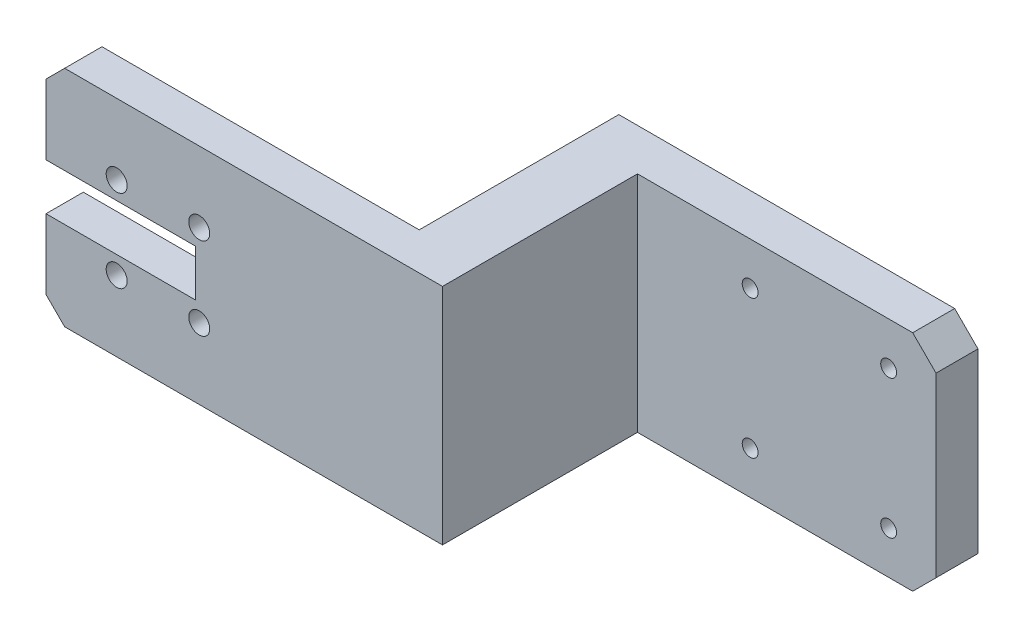
from build123d import *

# Parameters (mm, degrees)
SKETCH_1_R        = 3.75
EXTRUDE_244_DEPTH = 4
EXTRUDE_START     = 4
SKETCH_2_R        = 1.7
EXTRUDE_328_DEPTH = 5
EXTRUDE_START_2   = 9
SKETCH_3_W        = 13
SKETCH_3_H        = 48
EXTRUDE_401_DEPTH = 33.8
EXTRUDE_START_3   = 42.8
SKETCH_4_R        = 2.25
EXTRUDE_499_DEPTH = 8


with BuildPart() as part:
    # 草图1 → Extrude 244 (new body)
    with BuildSketch(Plane.XY):
        Polygon((48, -24), (120, -24), (125, -19), (125, 19), (120, 24), (48, 24), align=None)
        with Locations((85.155, -14.845)):
            Circle(SKETCH_1_R, mode=Mode.SUBTRACT)
        with Locations((85.155, 14.845)):
            Circle(SKETCH_1_R, mode=Mode.SUBTRACT)
        with Locations((114.845, -14.845)):
            Circle(SKETCH_1_R, mode=Mode.SUBTRACT)
        with Locations((114.845, 14.845)):
            Circle(SKETCH_1_R, mode=Mode.SUBTRACT)
    extrude(amount=EXTRUDE_244_DEPTH)

    # 草图2 → Extrude 328 (add)
    with BuildSketch(Plane.XY.offset(EXTRUDE_START)):
        Polygon((48, -24), (120, -24), (125, -19), (125, 19), (120, 24), (48, 24), align=None)
        with Locations((85.155, -14.845)):
            Circle(SKETCH_2_R, mode=Mode.SUBTRACT)
        with Locations((85.155, 14.845)):
            Circle(SKETCH_2_R, mode=Mode.SUBTRACT)
        with Locations((114.845, -14.845)):
            Circle(SKETCH_2_R, mode=Mode.SUBTRACT)
        with Locations((114.845, 14.845)):
            Circle(SKETCH_2_R, mode=Mode.SUBTRACT)
    extrude(amount=EXTRUDE_328_DEPTH)

    # 草图3 → Extrude 401 (add)
    with BuildSketch(Plane.XY.offset(EXTRUDE_START_2)):
        with Locations((54.5, 0)):
            Rectangle(SKETCH_3_W, SKETCH_3_H)
    extrude(amount=EXTRUDE_401_DEPTH)

    # 草图4 → Extrude 499 (add)
    with BuildSketch(Plane.XY.offset(EXTRUDE_START_3)):
        Polygon((-24, -20), (-20, -24), (61, -24), (61, 24), (-20, 24), (-24, 20), (-24, 5), (8, 5), (8, -5), (-24, -5), align=None)
        with Locations((-8.85, -8.85)):
            Circle(SKETCH_4_R, mode=Mode.SUBTRACT)
        with Locations((-8.85, 8.85)):
            Circle(SKETCH_4_R, mode=Mode.SUBTRACT)
        with Locations((8.85, -8.85)):
            Circle(SKETCH_4_R, mode=Mode.SUBTRACT)
        with Locations((8.85, 8.85)):
            Circle(SKETCH_4_R, mode=Mode.SUBTRACT)
    extrude(amount=EXTRUDE_499_DEPTH)


solid = part.part
